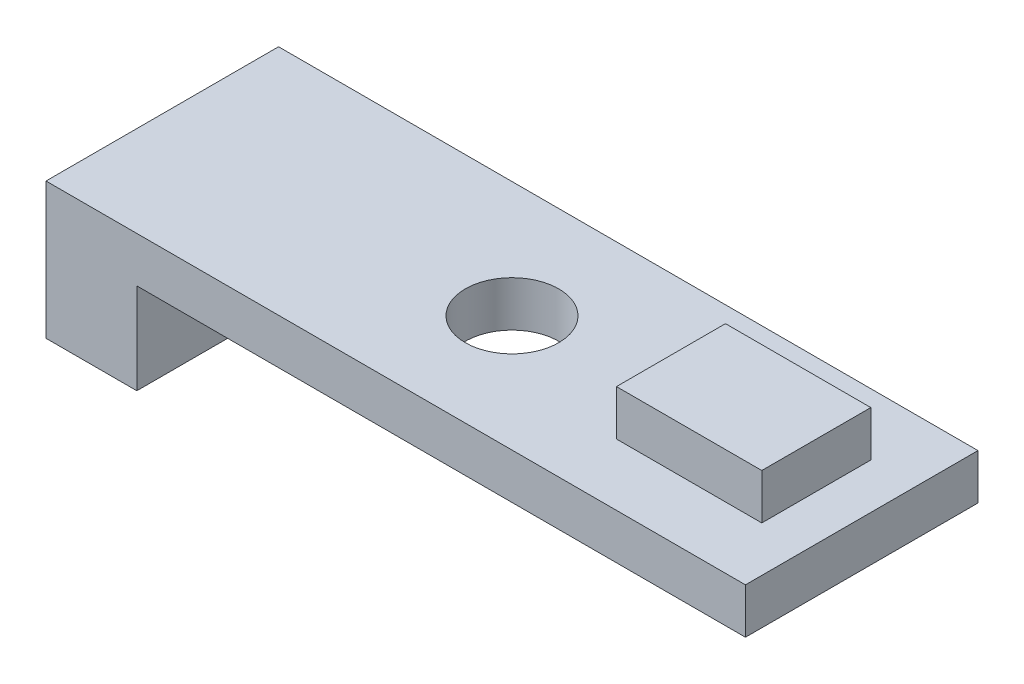
from build123d import *

# Parameters (mm, degrees)
SKETCH1_W           = 24.4475
SKETCH1_H           = 8.128
SKETCH1_R           = 1.63195
BOSS_EXTRUDE1_DEPTH = 1.5875
SKETCH2_W           = 5.08
SKETCH2_H           = 3.81
BOSS_EXTRUDE2_DEPTH = 1.5875
SKETCH3_W           = 3.175
SKETCH3_H           = 8.128
BOSS_EXTRUDE3_DEPTH = 3.175


with BuildPart() as part:
    # Sketch1 → Boss-Extrude1 (new body)
    with BuildSketch(Plane(origin=(0, 0, 0), x_dir=(1, 0, 0), z_dir=(0, 1, 0))):
        Rectangle(SKETCH1_W, SKETCH1_H)
        with Locations(Location((0, 0, 0), (0, 0, 270))):
            Circle(SKETCH1_R, mode=Mode.SUBTRACT)
    extrude(amount=BOSS_EXTRUDE1_DEPTH)

    # Sketch2 → Boss-Extrude2 (add)
    with BuildSketch(Plane(origin=(0, 1.5875, 0), x_dir=(1, 0, 0), z_dir=(0, 1, 0))):
        with Locations((8.09625, 0)):
            Rectangle(SKETCH2_W, SKETCH2_H)
    extrude(amount=BOSS_EXTRUDE2_DEPTH)

    # Sketch3 → Boss-Extrude3 (add)
    with BuildSketch(Plane.XZ):
        with Locations((-10.63625, 0)):
            Rectangle(SKETCH3_W, SKETCH3_H)
    extrude(amount=BOSS_EXTRUDE3_DEPTH)


solid = part.part
